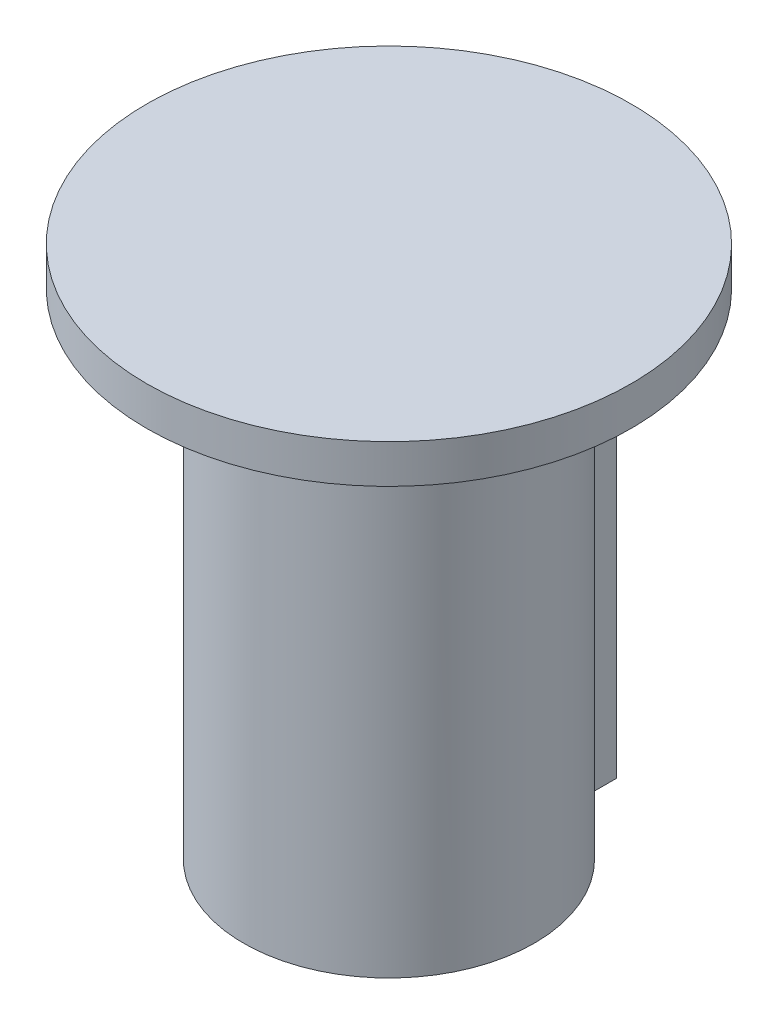
from build123d import *

# Parameters (mm, degrees)
EXTRUDE_2_DEPTH = 11
EXTRUDE_3_DEPTH = 6.6
SKETCH_3_R      = 5
EXTRUDE_4_DEPTH = 0.8


with BuildPart() as part:
    # 스케치1 → 보스-돌출2 (new body)
    with BuildSketch(Plane(origin=(0, 0, 0), x_dir=(1, 0, 0), z_dir=(0, 1, 0))):
        with BuildLine():
            ThreePointArc((0.9, 2.861817604), (0, 3), (-0.9, 2.861817604))
            ThreePointArc((-0.9, 2.861817604), (-1.774823935, -2.418677324), (3, 0))
            ThreePointArc((3, 0), (2.418677324, 1.774823935), (0.9, 2.861817604))
        make_face()
    extrude(amount=EXTRUDE_2_DEPTH)

    # 스케치1<3> → 보스-돌출3 (add)
    with BuildSketch(Plane(origin=(0, 0, 0), x_dir=(1, 0, 0), z_dir=(0, 1, 0))):
        with BuildLine():
            Line((-0.9, 3.8), (-0.9, 2.861817604))
            ThreePointArc((-0.9, 2.861817604), (0, 3), (0.9, 2.861817604))
            Line((0.9, 2.861817604), (0.9, 3.8))
            Line((0.9, 3.8), (-0.9, 3.8))
        make_face()
    extrude(amount=EXTRUDE_3_DEPTH)

    # 스케치3 → 보스-돌출4 (add)
    with BuildSketch(Plane(origin=(0, 11, 0), x_dir=(1, 0, 0), z_dir=(0, 1, 0))):
        Circle(SKETCH_3_R)
    extrude(amount=-EXTRUDE_4_DEPTH)


solid = part.part
